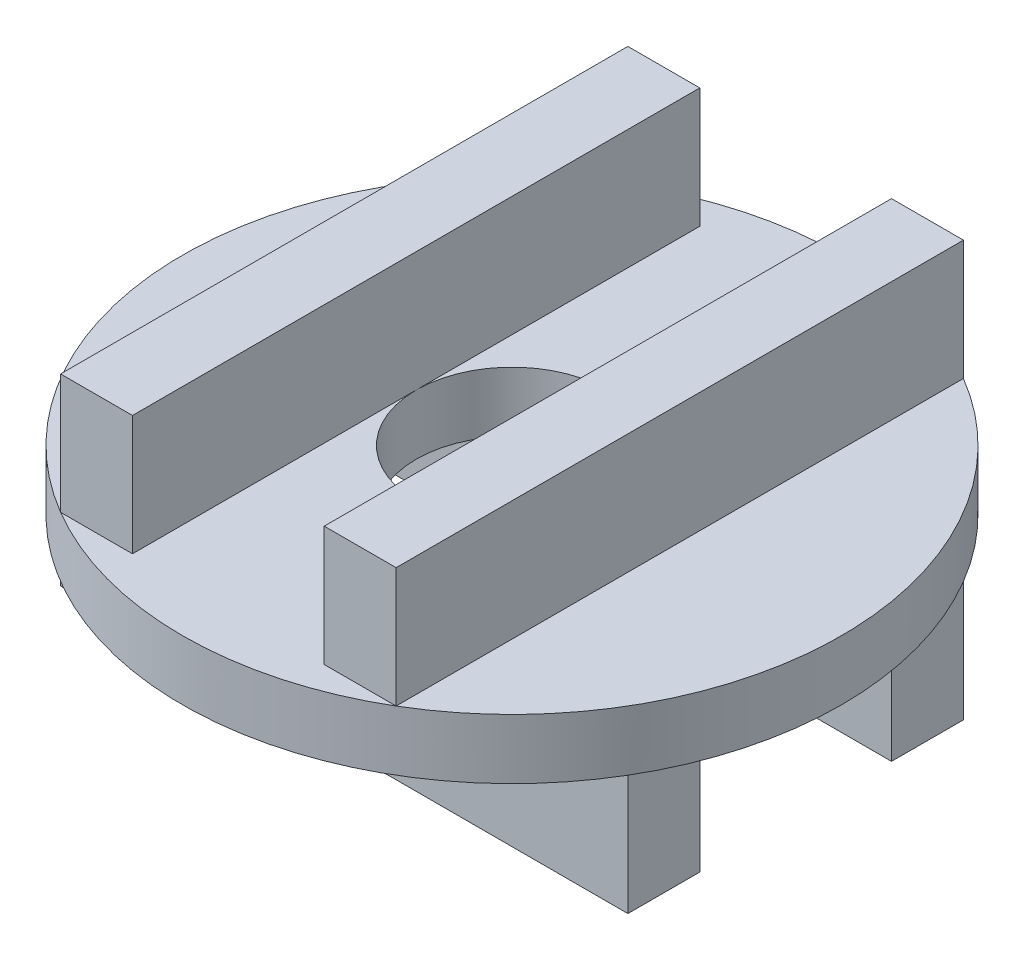
from build123d import *

# Parameters (mm, degrees)
SKETCH1_R           = 55
SKETCH1_R_2         = 16
BOSS_EXTRUDE1_DEPTH = 10
BOSS_EXTRUDE2_DEPTH = 20
SKETCH3_W           = 94.678403028
SKETCH3_H           = 12
BOSS_EXTRUDE3_DEPTH = 20


with BuildPart() as part:
    # Sketch1 → Boss-Extrude1 (new body)
    with BuildSketch(Plane(origin=(0, 0, 0), x_dir=(1, 0, 0), z_dir=(0, 1, 0))):
        with Locations(Location((0, 0, 0), (0, 0, 270))):
            Circle(SKETCH1_R)
        with Locations(Location((0, 0, 0), (0, 0, 270))):
            Circle(SKETCH1_R_2, mode=Mode.SUBTRACT)
    extrude(amount=BOSS_EXTRUDE1_DEPTH)

    # Sketch2 → Boss-Extrude2 (add)
    with BuildSketch(Plane(origin=(0, 10, 0), x_dir=(1, 0, 0), z_dir=(0, 1, 0))):
        Polygon((-16, 47.339201514), (-16, 0), (-16, -47.339201514), (-28, -47.339201514), (-28, 0), (-28, 47.339201514), align=None)
        Polygon((16, -47.339201514), (16, 0), (16, 47.339201514), (28, 47.339201514), (28, 0), (28, -47.339201514), align=None)
    extrude(amount=BOSS_EXTRUDE2_DEPTH)

    # Sketch3 → Boss-Extrude3 (add)
    with BuildSketch(Plane.XZ):
        with Locations((0, 22)):
            Rectangle(SKETCH3_W, SKETCH3_H)
        with Locations((0, -22)):
            Rectangle(SKETCH3_W, SKETCH3_H)
    extrude(amount=BOSS_EXTRUDE3_DEPTH)


solid = part.part
